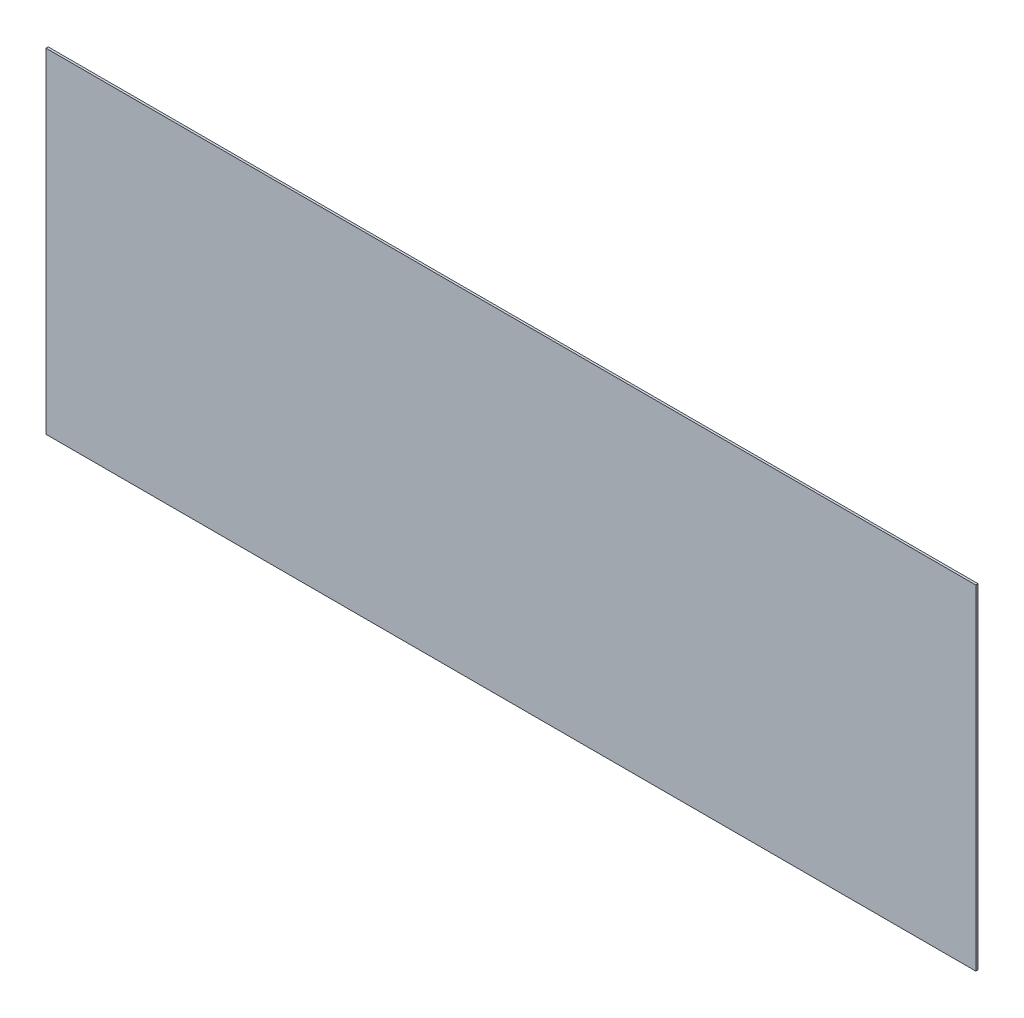
from build123d import *

# Parameters (mm, degrees)
SKETCH2_W           = 620
SKETCH2_H           = 223
BOSS_EXTRUDE1_DEPTH = 1.5


with BuildPart() as part:
    # Sketch2 → Boss-Extrude1 (new body)
    with BuildSketch(Plane.XY):
        with Locations((310, 111.5)):
            Rectangle(SKETCH2_W, SKETCH2_H)
    extrude(amount=BOSS_EXTRUDE1_DEPTH)


solid = part.part
